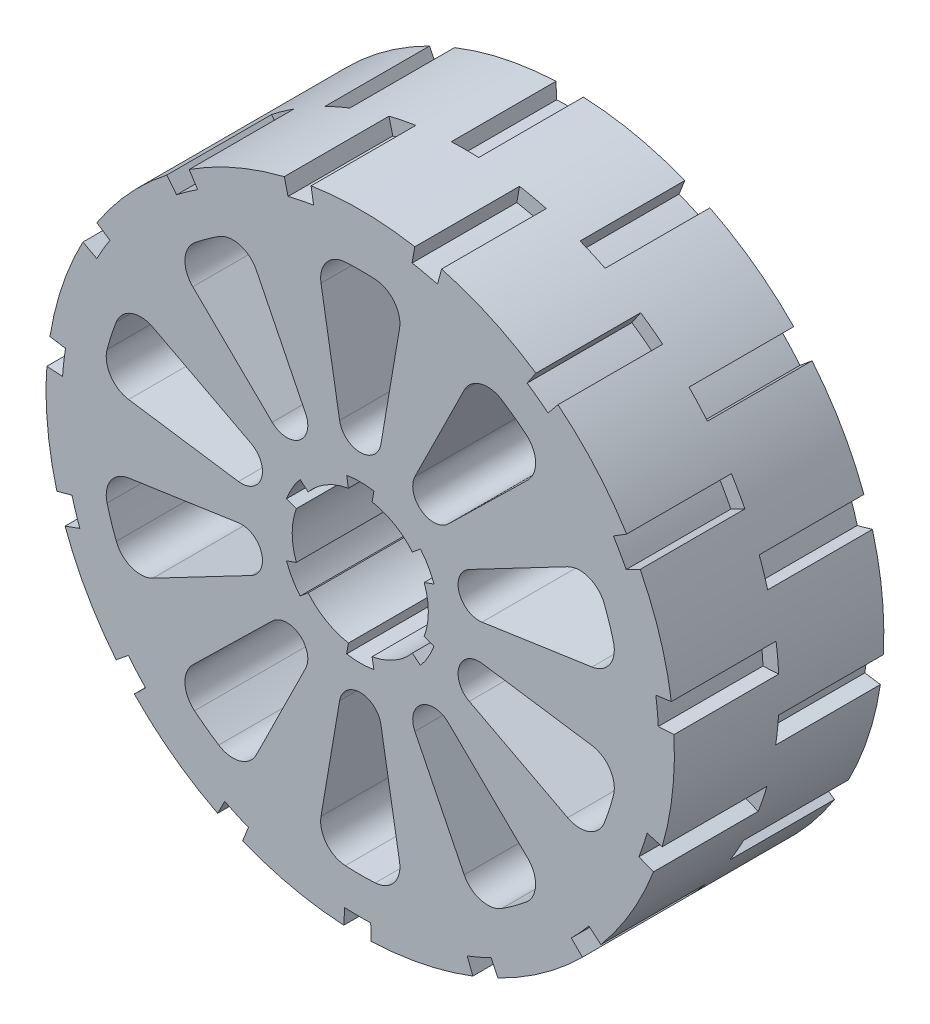
from build123d import *

# Parameters (mm, degrees)
ESQUISSE1_R             = 60
BOSS_EXTRU_1_DEPTH      = 40
CUT_EXTRUDE4_DEPTH      = 94.808315196
CIRPATTERN1_COUNT       = 10
SKETCH4_R               = 9
BOSS_EXTRUDE1_DEPTH     = 10
SKETCH5_R               = 5
CUT_EXTRUDE5_DEPTH      = 99.488578018
CUT_EXTRUDE6_START      = -20
CUT_EXTRUDE6_DEPTH      = 20
CIRPATTERN2_COUNT       = 15
CUT_EXTRUDE7_DEPTH      = 20
CIRPATTERN3_COUNT       = 15
CUT_EXTRUDE8_DEPTH      = 94.808315196
CUT_EXTRUDE8_DEPTH_BACK = 94.808315196


with BuildPart() as part:
    # Esquisse1 → Boss.-Extru.1 (new body)
    with BuildSketch(Plane.XY):
        Circle(ESQUISSE1_R)
    extrude(amount=BOSS_EXTRU_1_DEPTH)

    # Sketch3 → Cut-Extrude4 (cut, symmetric)
    with BuildSketch(Plane.XY):
        with BuildLine():
            Line((-3.943348831, 23.180571367), (-7.5, 44.087980221))
            ThreePointArc((-7.5, 44.087980221), (-6.481937987, 48.04148707), (-2.856459957, 49.918339681))
            ThreePointArc((-2.856459957, 49.918339681), (0, 50), (2.856459957, 49.918339681))
            ThreePointArc((2.856459957, 49.918339681), (6.481937987, 48.04148707), (7.5, 44.087980221))
            Line((7.5, 44.087980221), (3.943348831, 23.180571367))
            ThreePointArc((3.943348831, 23.180571367), (0, 19.85139176), (-3.943348831, 23.180571367))
        make_face()
    cut_extrude4 = extrude(amount=CUT_EXTRUDE4_DEPTH, both=True, mode=Mode.SUBTRACT)

    # CirPattern1: Cut-Extrude4 ×10 about axis
    cirpattern1_axis = Axis((0, 0, -85.404512518), (0, 0, 1))
    for i in range(1, CIRPATTERN1_COUNT):
        add(cut_extrude4.rotate(cirpattern1_axis, i * 360 / CIRPATTERN1_COUNT), mode=Mode.SUBTRACT)

    # Sketch4 → Boss-Extrude1 (add)
    with BuildSketch(Plane.XY.offset(40)):
        Circle(SKETCH4_R)
    extrude(amount=BOSS_EXTRUDE1_DEPTH)

    # Sketch5 → Cut-Extrude5 (cut, through all)
    with BuildSketch(Plane.XY.offset(50)):
        Circle(SKETCH5_R)
    extrude(amount=-CUT_EXTRUDE5_DEPTH, mode=Mode.SUBTRACT)

    # Sketch6 → Cut-Extrude6 (cut)
    with BuildSketch(Plane.XY.offset(40).offset(CUT_EXTRUDE6_START)):
        with BuildLine():
            ThreePointArc((15.529142706, 57.955549577), (12.986376836, 58.577760427), (10.41889066, 59.088465181))
            Line((10.41889066, 59.088465181), (9.897946127, 56.134041922))
            ThreePointArc((9.897946127, 56.134041922), (12.337057994, 55.648872406), (14.752685571, 55.057772098))
            Line((14.752685571, 55.057772098), (15.529142706, 57.955549577))
        make_face()
    cut_extrude6 = extrude(amount=CUT_EXTRUDE6_DEPTH, mode=Mode.SUBTRACT)

    # CirPattern2: Cut-Extrude6 ×15 about axis
    cirpattern2_axis = Axis((0, 0, -85.404512518), (0, 0, 1))
    for i in range(1, CIRPATTERN2_COUNT):
        add(cut_extrude6.rotate(cirpattern2_axis, i * 360 / CIRPATTERN2_COUNT), mode=Mode.SUBTRACT)

    # Sketch7 → Cut-Extrude7 (cut)
    with BuildSketch(Plane(origin=(0, 0, 0), x_dir=(-1, 0, 0), z_dir=(0, 0, -1))):
        with BuildLine():
            Line((-2.617163242, 59.942893295), (-2.48630508, 56.94574863))
            ThreePointArc((-2.48630508, 56.94574863), (0, 57), (2.48630508, 56.94574863))
            Line((2.48630508, 56.94574863), (2.617163242, 59.942893295))
            ThreePointArc((2.617163242, 59.942893295), (0, 60), (-2.617163242, 59.942893295))
        make_face()
    cut_extrude7 = extrude(amount=-CUT_EXTRUDE7_DEPTH, mode=Mode.SUBTRACT)

    # CirPattern3: Cut-Extrude7 ×15 about axis
    cirpattern3_axis = Axis((0, 0, 15), (0, 0, -1))
    for i in range(1, CIRPATTERN3_COUNT):
        add(cut_extrude7.rotate(cirpattern3_axis, i * 360 / CIRPATTERN3_COUNT), mode=Mode.SUBTRACT)

    # Sketch8 → Cut-Extrude8 (cut, two sides: drawn at the far end of the back side and taken through both)
    with BuildSketch(Plane.XY.offset(40).offset(-CUT_EXTRUDE8_DEPTH_BACK)):
        with BuildLine():
            Line((-2.604722665, 14.772116295), (-2.25742631, 12.802500789))
            ThreePointArc((-2.25742631, 12.802500789), (-6.5, 11.258330249), (-9.958577761, 8.356238926))
            Line((-9.958577761, 8.356238926), (-11.490666647, 9.641814145))
            ThreePointArc((-11.490666647, 9.641814145), (-12.990381057, 7.5), (-14.095389312, 5.13030215))
            Line((-14.095389312, 5.13030215), (-12.21600407, 4.446261863))
            ThreePointArc((-12.21600407, 4.446261863), (-13, 0), (-12.21600407, -4.446261863))
            Line((-12.21600407, -4.446261863), (-14.095389312, -5.13030215))
            ThreePointArc((-14.095389312, -5.13030215), (-12.990381057, -7.5), (-11.490666647, -9.641814145))
            Line((-11.490666647, -9.641814145), (-9.958577761, -8.356238926))
            ThreePointArc((-9.958577761, -8.356238926), (-6.5, -11.258330249), (-2.25742631, -12.802500789))
            Line((-2.25742631, -12.802500789), (-2.604722665, -14.772116295))
            ThreePointArc((-2.604722665, -14.772116295), (0, -15), (2.604722665, -14.772116295))
            Line((2.604722665, -14.772116295), (2.25742631, -12.802500789))
            ThreePointArc((2.25742631, -12.802500789), (6.5, -11.258330249), (9.958577761, -8.356238926))
            Line((9.958577761, -8.356238926), (11.490666647, -9.641814145))
            ThreePointArc((11.490666647, -9.641814145), (12.990381057, -7.5), (14.095389312, -5.13030215))
            Line((14.095389312, -5.13030215), (12.21600407, -4.446261863))
            ThreePointArc((12.21600407, -4.446261863), (13, 0), (12.21600407, 4.446261863))
            Line((12.21600407, 4.446261863), (14.095389312, 5.13030215))
            ThreePointArc((14.095389312, 5.13030215), (12.990381057, 7.5), (11.490666647, 9.641814145))
            Line((11.490666647, 9.641814145), (9.958577761, 8.356238926))
            ThreePointArc((9.958577761, 8.356238926), (6.5, 11.258330249), (2.25742631, 12.802500789))
            Line((2.25742631, 12.802500789), (2.604722665, 14.772116295))
            ThreePointArc((2.604722665, 14.772116295), (0, 15), (-2.604722665, 14.772116295))
        make_face()
    extrude(amount=CUT_EXTRUDE8_DEPTH + CUT_EXTRUDE8_DEPTH_BACK, mode=Mode.SUBTRACT)


solid = part.part
